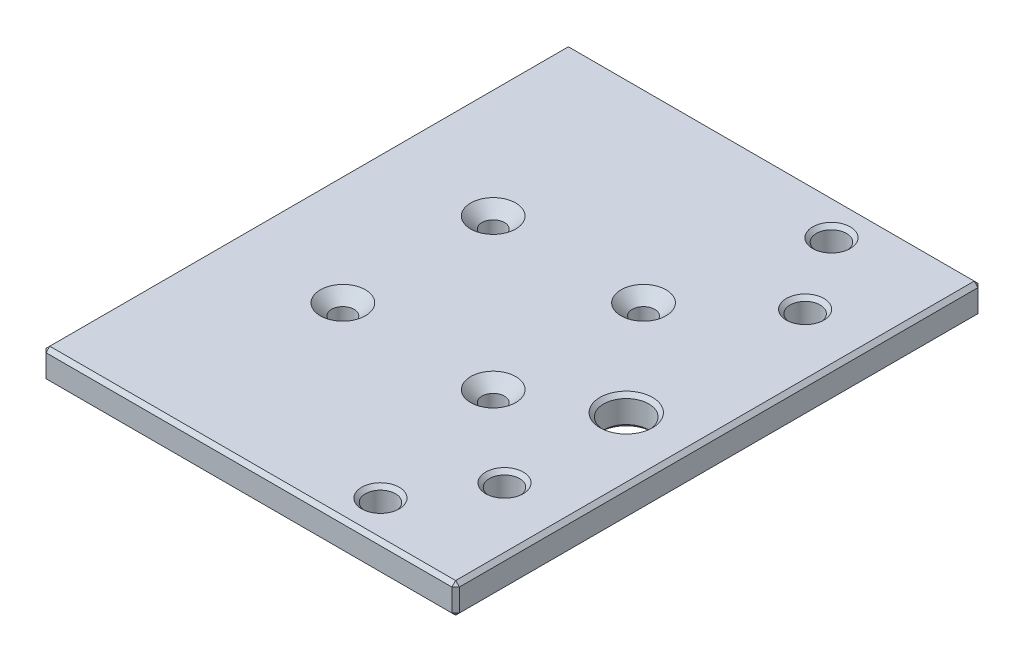
from build123d import *

# Parameters (mm, degrees)
CROQUIS1_W              = 55
CROQUIS1_H              = 70
CROQUIS1_R              = 1.5
CROQUIS1_R_2            = 2
CROQUIS1_R_3            = 3
SALIENTE_EXTRUIR1_DEPTH = 4
CHAFL_N1_SIZE           = 0.5
CHAFL_N2_SIZE           = 1.5


with BuildPart() as part:
    # Croquis1 → Saliente-Extruir1 (new body)
    with BuildSketch(Plane(origin=(0, 0, 0), x_dir=(1, 0, 0), z_dir=(0, 1, 0))):
        with Locations((19.480956658, 1.278538813)):
            Rectangle(CROQUIS1_W, CROQUIS1_H)
        with Locations(Location((6.980956658, 11.278538813, 0), (0, 0, 270))):
            Circle(CROQUIS1_R, mode=Mode.SUBTRACT)
        with Locations(Location((26.980956658, 11.278538813, 0), (0, 0, 270))):
            Circle(CROQUIS1_R, mode=Mode.SUBTRACT)
        with Locations(Location((6.980956658, -8.721461187, 0), (0, 0, 270))):
            Circle(CROQUIS1_R, mode=Mode.SUBTRACT)
        with Locations(Location((26.980956658, -8.721461187, 0), (0, 0, 270))):
            Circle(CROQUIS1_R, mode=Mode.SUBTRACT)
        with Locations(Location((31.980956658, 31.278538813, 0), (0, 0, 270))):
            Circle(CROQUIS1_R_2, mode=Mode.SUBTRACT)
        with Locations(Location((31.980956658, -28.721461187, 0), (0, 0, 270))):
            Circle(CROQUIS1_R_2, mode=Mode.SUBTRACT)
        with Locations(Location((38.480956658, -18.721461187, 0), (0, 0, 270))):
            Circle(CROQUIS1_R_2, mode=Mode.SUBTRACT)
        with Locations(Location((38.480956658, -2.521461187, 0), (0, 0, 270))):
            Circle(CROQUIS1_R_3, mode=Mode.SUBTRACT)
        with Locations(Location((38.480956658, 21.278538813, 0), (0, 0, 270))):
            Circle(CROQUIS1_R_2, mode=Mode.SUBTRACT)
    extrude(amount=SALIENTE_EXTRUIR1_DEPTH)

    # Chaflán1
    chafl_n1_edges = [part.edges().sort_by_distance(p)[0] for p in [
        (46.980956658, 4, -1.278538813),
        (6.980956658, 0, -12.778538813),
        (19.480956658, 4, -36.278538813),
        (26.980956658, 0, -12.778538813),
        (6.980956658, 0, 7.221461187),
        (26.980956658, 0, 7.221461187),
        (31.980956658, 0, -33.278538813),
        (31.980956658, 4, -33.278538813),
        (31.980956658, 0, 26.721461187),
        (31.980956658, 4, 26.721461187),
        (38.480956658, 0, 16.721461187),
        (38.480956658, 4, 16.721461187),
        (38.480956658, 0, -0.478538813),
        (38.480956658, 4, -0.478538813),
        (-8.019043342, 4, -1.278538813),
        (38.480956658, 0, -23.278538813),
        (38.480956658, 4, -23.278538813),
        (19.480956658, 0, -36.278538813),
        (46.980956658, 0, -1.278538813),
        (19.480956658, 0, 33.721461187),
        (-8.019043342, 0, -1.278538813),
        (19.480956658, 4, 33.721461187),
        (-8.019043342, 2, -36.278538813),
        (46.980956658, 2, -36.278538813),
        (46.980956658, 2, 33.721461187),
        (-8.019043342, 2, 33.721461187),
    ]]
    chamfer(chafl_n1_edges, length=CHAFL_N1_SIZE)

    # Chaflán2
    chafl_n2_edges = [part.edges().sort_by_distance(p)[0] for p in [
        (6.980956658, 4, -12.778538813),
        (26.980956658, 4, -12.778538813),
        (6.980956658, 4, 7.221461187),
        (26.980956658, 4, 7.221461187),
    ]]
    chamfer(chafl_n2_edges, length=CHAFL_N2_SIZE)


solid = part.part
